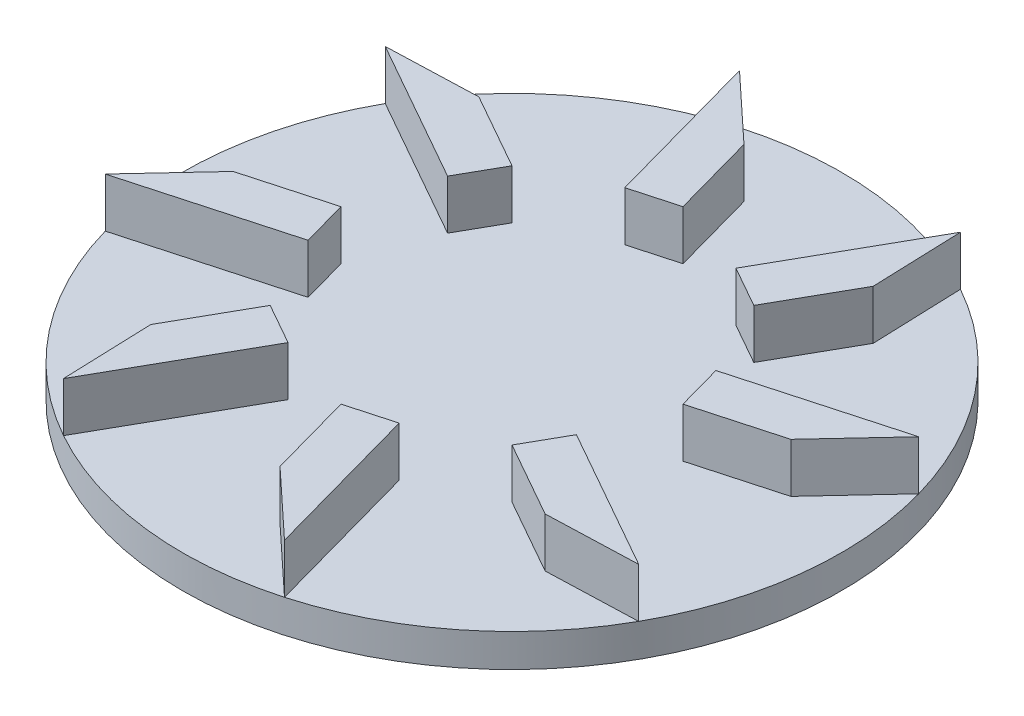
from build123d import *

# Parameters (mm, degrees)
SKETCH_1_R      = 20
EXTRUDE_1_DEPTH = 2
EXTRUDE_2_DEPTH = 3


with BuildPart() as part:
    # 草图1 → 凸台-拉伸1 (new body)
    with BuildSketch(Plane(origin=(0, 0, 0), x_dir=(1, 0, 0), z_dir=(0, 1, 0))):
        with Locations(Location((0, 0, 0), (0, 0, 270))):
            Circle(SKETCH_1_R)
    extrude(amount=EXTRUDE_1_DEPTH)

    # 草图2 → 凸台-拉伸2 (add)
    with BuildSketch(Plane(origin=(0, 2, 0), x_dir=(1, 0, 0), z_dir=(0, 1, 0))):
        Polygon((1.422012769, -15.50129709), (0, -10.377789627), (2.764347063, -9.610554125), (5.438718845, -19.246307109), align=None)
        Polygon((-9.955557418, -11.966587161), (-7.338205419, -7.338205419), (-4.840999439, -8.750376546), (-9.763439294, -17.454949245), align=None)
        Polygon((-15.50129709, -1.422012769), (-10.377789627, 0), (-9.610554125, -2.764347063), (-19.246307109, -5.438718845), align=None)
        Polygon((-11.966587161, 9.955557418), (-7.338205419, 7.338205419), (-8.750376546, 4.840999439), (-17.454949245, 9.763439294), align=None)
        Polygon((-1.422012769, 15.50129709), (0, 10.377789627), (-2.764347063, 9.610554125), (-5.438718845, 19.246307109), align=None)
        Polygon((9.955557418, 11.966587161), (7.338205419, 7.338205419), (4.840999439, 8.750376546), (9.763439294, 17.454949245), align=None)
        Polygon((15.50129709, 1.422012769), (10.377789627, 0), (9.610554125, 2.764347063), (19.246307109, 5.438718845), align=None)
        Polygon((11.966587161, -9.955557418), (7.338205419, -7.338205419), (8.750376546, -4.840999439), (17.454949245, -9.763439294), align=None)
    extrude(amount=EXTRUDE_2_DEPTH)


solid = part.part
